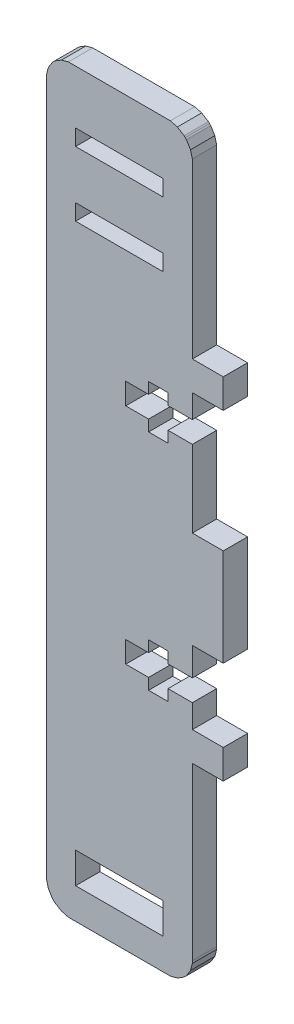
from build123d import *

# Parameters (mm, degrees)
SKETCH1_W           = 18.00098
SKETCH1_H           = 6.35
SKETCH1_W_2         = 18.02638
SKETCH1_H_2         = 3.302
SKETCH1_H_3         = 3.29692
BOSS_EXTRUDE1_DEPTH = 5


with BuildPart() as part:
    # Sketch1 → Boss-Extrude1 (new body)
    with BuildSketch(Plane.XY):
        Polygon((-13.17371, -76.15047), (6.82625, -76.15047), (7.30377, -76.15047), (8.73887, -75.76947), (10.12571, -74.91857), (10.36193, -74.68489), (10.59815, -74.45121), (11.44651, -73.06437), (11.82751, -71.62673), (11.82497, -71.15175), (11.82497, -36.00069), (18.17497, -36.00069), (18.17497, -30.00121), (11.82497, -30.00121), (11.82497, -25.19807), (6.82625, -25.19807), (6.82625, -27.49931), (2.82575, -27.49931), (2.82575, -25.19807), (-1.87579, -25.19807), (-1.87579, -20.79879), (2.82575, -20.79879), (2.82575, -18.50009), (6.82625, -18.50009), (6.82625, -20.79879), (11.82497, -20.79879), (11.82497, -14.99997), (18.17497, -14.99997), (18.17497, 4.99999), (11.82497, 4.99999), (11.82497, 20.79879), (6.82625, 20.79879), (6.82625, 18.50009), (2.82575, 18.50009), (2.82575, 20.79879), (-1.87579, 20.79879), (-1.87579, 25.19807), (2.82575, 25.19807), (2.82575, 27.49931), (6.82625, 27.49931), (6.82625, 25.19807), (11.82497, 25.19807), (11.82497, 30.00121), (18.17497, 30.00121), (18.17497, 36.00069), (11.82497, 36.00069), (11.82497, 71.14921), (11.82497, 71.62673), (11.44397, 73.06437), (10.59561, 74.45121), (10.36193, 74.68743), (10.12571, 74.91857), (8.73887, 75.76947), (7.30377, 76.15047), (6.82625, 76.15047), (-13.17371, 76.15047), (-13.65377, 76.15047), (-15.08887, 75.76947), (-16.47571, 74.91857), (-16.70939, 74.68743), (-16.94561, 74.45121), (-17.79397, 73.06437), (-18.17497, 71.62673), (-18.17497, 71.14921), (-18.17497, -71.15175), (-18.17497, -71.62673), (-17.79397, -73.06437), (-16.94561, -74.45121), (-16.70939, -74.68489), (-16.47571, -74.91857), (-15.08887, -75.76947), (-13.65377, -76.15047), align=None)
        with Locations((-3.175, -66.62547)):
            Rectangle(SKETCH1_W, SKETCH1_H, mode=Mode.SUBTRACT)
        with Locations((-3.175, 63.47587)):
            Rectangle(SKETCH1_W_2, SKETCH1_H_2, mode=Mode.SUBTRACT)
        with Locations((-3.175, 50.17389)):
            Rectangle(SKETCH1_W_2, SKETCH1_H_3, mode=Mode.SUBTRACT)
    extrude(amount=BOSS_EXTRUDE1_DEPTH)


solid = part.part
